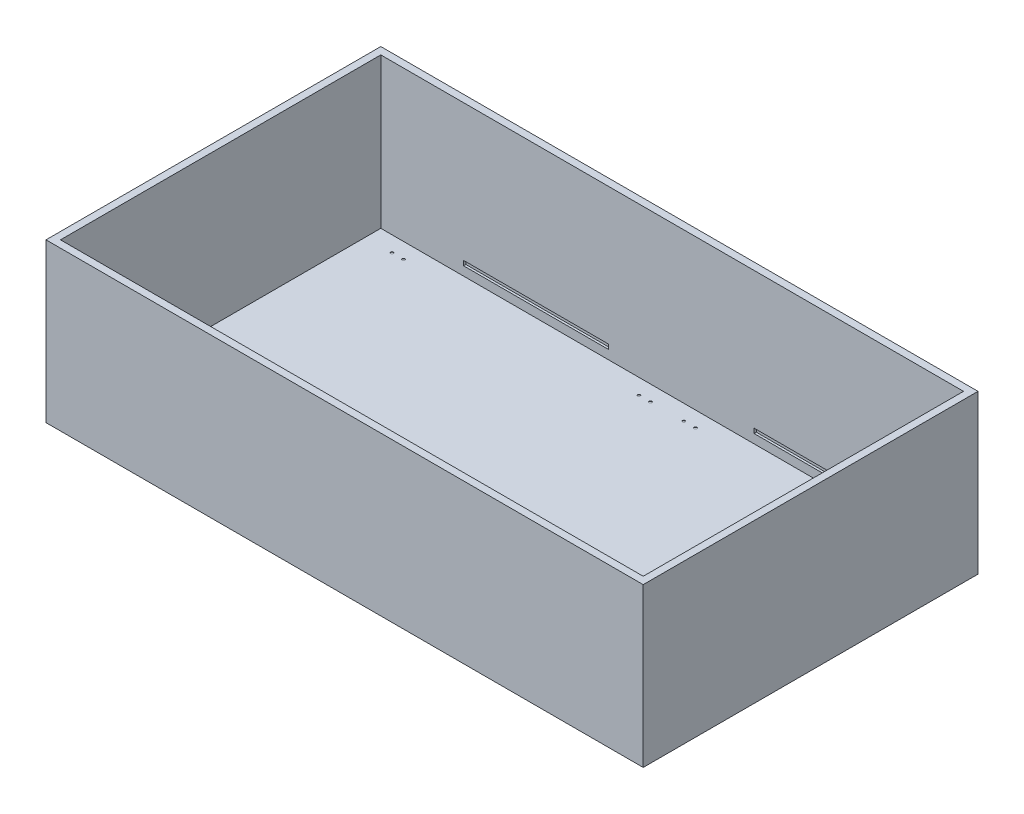
from build123d import *

# Parameters (mm, degrees)
CROQUIS1_W                       = 1320
CROQUIS1_H                       = 740
SALIENTE_EXTRUIR1_DEPTH          = 350
CROQUIS2_W                       = 1288
CROQUIS2_H                       = 708
CORTAR_EXTRUIR1_DEPTH            = 332
TALADRO_DE_MARGEN_PARA_M61_D     = 6
TALADRO_DE_MARGEN_PARA_M61_DEPTH = 1
TALADRO_DE_MARGEN_PARA_M62_D     = 6
TALADRO_DE_MARGEN_PARA_M62_DEPTH = 1
CORTAR_EXTRUIR2_START            = -143
CROQUIS7_W                       = 5
CROQUIS7_H                       = 10.328249786
CORTAR_EXTRUIR2_DEPTH            = 320
CORTAR_EXTRUIR3_START            = -183
CROQUIS8_W                       = 5
CROQUIS8_H                       = 10.328249786
CORTAR_EXTRUIR3_DEPTH            = 320


with BuildPart() as part:
    # Croquis1 → Saliente-Extruir1 (new body)
    with BuildSketch(Plane(origin=(0, 0, 0), x_dir=(1, 0, 0), z_dir=(0, 1, 0))):
        Rectangle(CROQUIS1_W, CROQUIS1_H)
    extrude(amount=SALIENTE_EXTRUIR1_DEPTH)

    # Croquis2 → Cortar-Extruir1 (cut)
    with BuildSketch(Plane(origin=(0, 350, 0), x_dir=(1, 0, 0), z_dir=(0, 1, 0))):
        Rectangle(CROQUIS2_W, CROQUIS2_H)
    extrude(amount=-CORTAR_EXTRUIR1_DEPTH, mode=Mode.SUBTRACT)

    # Taladro de margen para M61
    with Locations(Plane(origin=(275.040116616, 18, -214.423302292), x_dir=(1, 0, 0), z_dir=(0, 1, 0))):
        with Locations((-831.164543187, -520.352285028), (-831.164543187, -546.055205699), (-855.664607514, -546.055205699), (-855.664607514, -520.352285028)):
            Hole(TALADRO_DE_MARGEN_PARA_M61_D / 2, depth=TALADRO_DE_MARGEN_PARA_M61_DEPTH)

    # Taladro de margen para M62
    with Locations(Plane(origin=(275.040116616, 18, -214.423302292), x_dir=(1, 0, 0), z_dir=(0, 1, 0))):
        with Locations((-859.800116616, 105.076697708), (-834.300547142, 105.075612323), (-314.039673698, 105.075612323), (-288.540104225, 105.075612323), (-214.748048522, 105.075612323), (-188.969749284, 105.075612323), (326.914692955, 105.075612323), (352.414262429, 105.075612323), (323.921080143, -520.352285028), (348.42114447, -520.352285028), (348.42114447, -546.055205699), (323.921080143, -546.055205699), (-185.793163735, -520.352285028), (-185.793163735, -546.055205699), (-214.649068849, -547.297061638), (-210.293228062, -520.352285028), (-292.457959943, -520.352285028), (-292.457959943, -546.055205699), (-316.95802427, -546.055205699), (-316.95802427, -520.352285028)):
            Hole(TALADRO_DE_MARGEN_PARA_M62_D / 2, depth=TALADRO_DE_MARGEN_PARA_M62_DEPTH)

    # Croquis7 → Cortar-Extruir2 (cut)
    with BuildSketch(Plane(origin=(644, 0, -214.423302292), x_dir=(0, 0, -1), z_dir=(1, 0, 0)).offset(CORTAR_EXTRUIR2_START)):
        with Locations((142.076697708, 42.95033831)):
            Rectangle(CROQUIS7_W, CROQUIS7_H)
    extrude(amount=-CORTAR_EXTRUIR2_DEPTH, mode=Mode.SUBTRACT)

    # Croquis8 → Cortar-Extruir3 (cut)
    with BuildSketch(Plane(origin=(-644, 0, -214.423302292), x_dir=(0, 0, 1), z_dir=(-1, 0, 0)).offset(CORTAR_EXTRUIR3_START)):
        with Locations((-142.076697708, 42.95033831)):
            Rectangle(CROQUIS8_W, CROQUIS8_H)
    extrude(amount=-CORTAR_EXTRUIR3_DEPTH, mode=Mode.SUBTRACT)


solid = part.part
